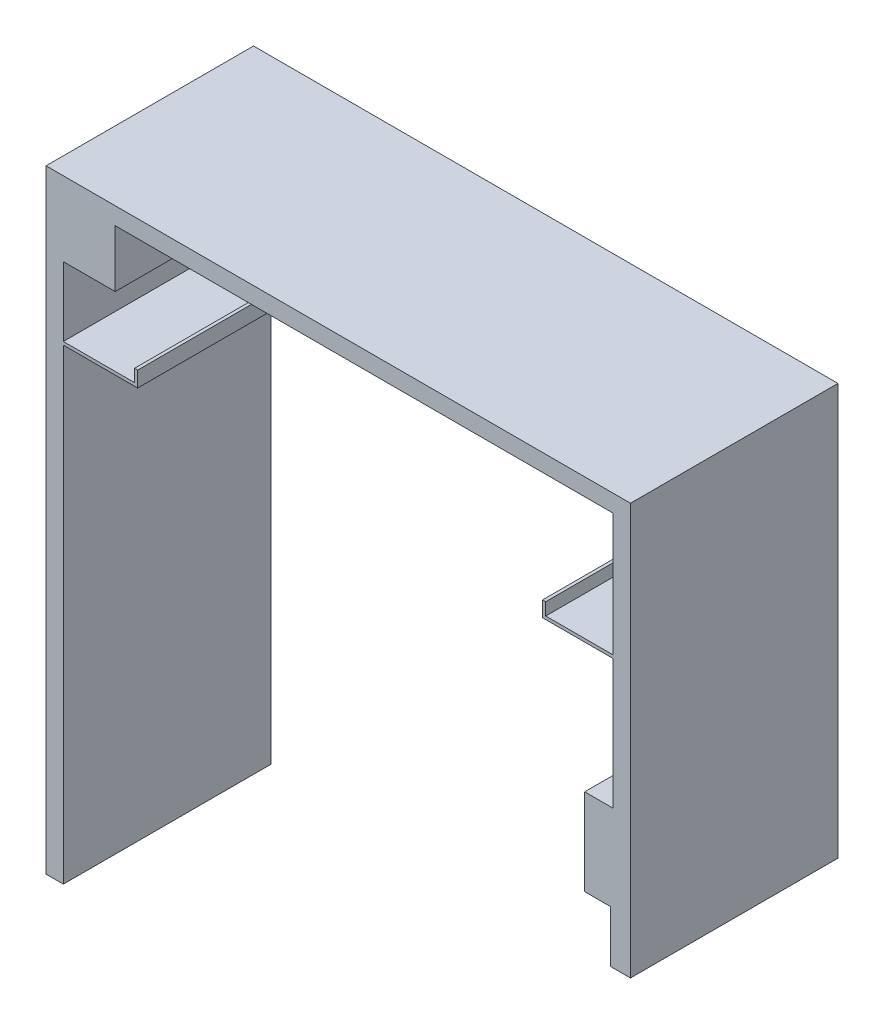
from build123d import *

# Parameters (mm, degrees)
BOSS_EXTRU_1_DEPTH = 1200


with BuildPart() as part:
    # Esquisse1 → Boss.-Extru.1 (new body)
    with BuildSketch(Plane.XY):
        Polygon((0, 0), (0, 2700), (430, 2700), (430, 2790), (412, 2790), (412, 2718), (0, 2718), (0, 3118), (300, 3118), (300, 3448), (3180, 3448), (3180, 2738), (2790, 2738), (2790, 2810), (2772, 2810), (2772, 2720), (3180, 2720), (3180, 1970), (3015, 1970), (3015, 1470), (3165, 1470), (3165, 1170), (3280, 1170), (3280, 3548), (-100, 3548), (-100, 0), align=None)
    extrude(amount=BOSS_EXTRU_1_DEPTH)


solid = part.part
